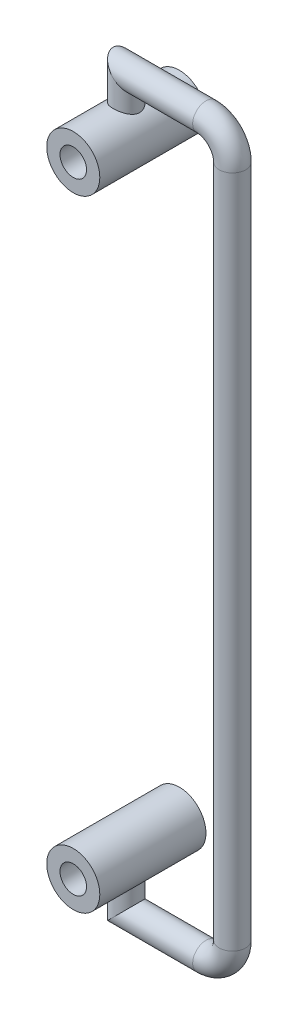
from build123d import *

# Parameters (mm, degrees)
ESQUISSE2_R             = 2.5
BOSS_EXTRU_1_DEPTH      = 10
BOSS_EXTRU_1_DEPTH_BACK = 10
ESQUISSE3_R             = 5
ESQUISSE3_R_2           = 2.5
ESQUISSE5_R             = 2.5
ENL_V_MAT_EXTRU_1_DEPTH = 143.711247056


with BuildPart() as part:
    # Balayage1: sweep along a path in Esquisse1
    with BuildLine(Plane.XY) as balayage1_path:
        Line((0, 127), (0, 137))
        Line((0, 137), (15, 137))
        ThreePointArc((15, 137), (18.535533906, 135.535533906), (20, 132))
        Line((20, 132), (20, 5))
        ThreePointArc((20, 5), (18.535533906, 1.464466094), (15, 0))
        Line((15, 0), (0, 0))
        Line((0, 0), (0, 10))
    # Esquisse2 → Balayage1 (sweep)
    with BuildSketch(Plane(origin=(0, 127, 0), x_dir=(1, 0, 0), z_dir=(0, 1, 0))):
        Circle(ESQUISSE2_R)
    sweep(path=balayage1_path.line, transition=Transition.RIGHT)

    # Esquisse3 → Boss.-Extru.1 (add, two sides: drawn at the far end of the back side and taken through both)
    # profile 1 of 2: a face of its own
    with BuildSketch(Plane.XY.offset(-BOSS_EXTRU_1_DEPTH_BACK)):
        with Locations((0, 127)):
            Circle(ESQUISSE3_R)
        with Locations((0, 127)):
            Circle(ESQUISSE3_R_2, mode=Mode.SUBTRACT)
    # profile 2 of 2: a face of its own
    with BuildSketch(Plane.XY.offset(-BOSS_EXTRU_1_DEPTH_BACK)):
        with Locations((0, 10)):
            Circle(ESQUISSE3_R)
        with Locations((0, 10)):
            Circle(ESQUISSE3_R_2, mode=Mode.SUBTRACT)
    extrude(amount=BOSS_EXTRU_1_DEPTH + BOSS_EXTRU_1_DEPTH_BACK)

    # Esquisse5 → Enlèv. mat.-Extru.1 (cut, through all)
    with BuildSketch(Plane.XY.offset(10)):
        with Locations((0, 127)):
            Circle(ESQUISSE5_R)
        with Locations((0, 10)):
            Circle(ESQUISSE5_R)
    extrude(amount=-ENL_V_MAT_EXTRU_1_DEPTH, mode=Mode.SUBTRACT)


solid = part.part
